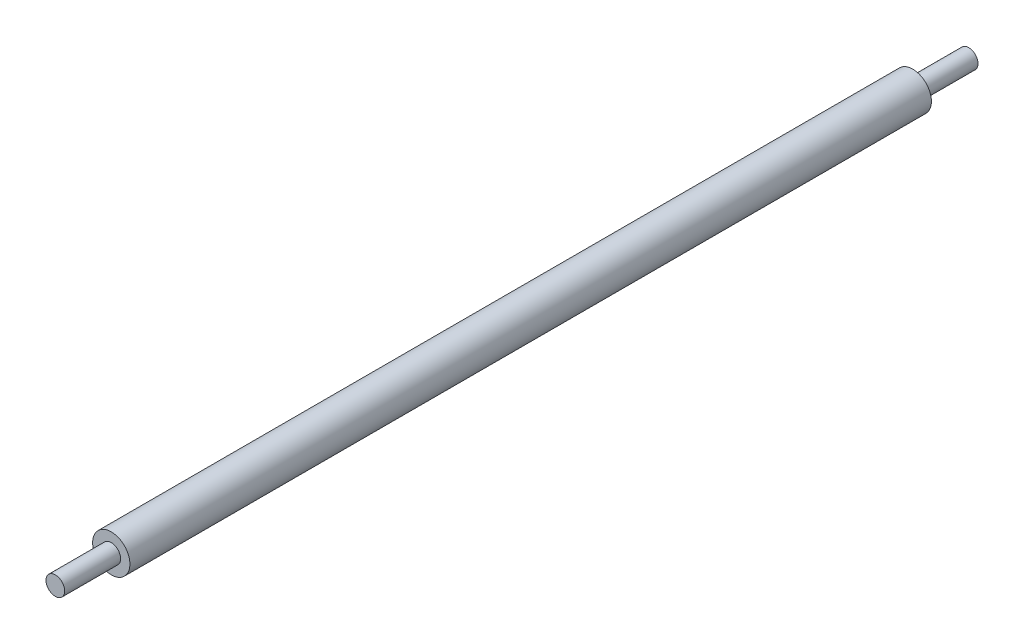
from build123d import *

# Parameters (mm, degrees)
SKETCH1_R           = 12.7
BOSS_EXTRUDE1_DEPTH = 622.3
SKETCH2_OUTSIDE_W   = 152.068
SKETCH2_OUTSIDE_H   = 152.068
SKETCH2_OUTSIDE_R   = 6.361935525
CUT_EXTRUDE1_DEPTH  = 38.1
SKETCH5_OUTSIDE_W   = 152.068
SKETCH5_OUTSIDE_H   = 152.068
SKETCH5_OUTSIDE_R   = 6.377907631
CUT_EXTRUDE4_DEPTH  = 38.1


with BuildPart() as part:
    # Sketch1 → Boss-Extrude1 (new body)
    with BuildSketch(Plane.XY):
        Circle(SKETCH1_R)
    extrude(amount=BOSS_EXTRUDE1_DEPTH)

    # Sketch2 outside → Cut-Extrude1 (cut)
    with BuildSketch(Plane.XY):
        Rectangle(SKETCH2_OUTSIDE_W, SKETCH2_OUTSIDE_H)
        with Locations(Location((0, 0, 0), (0, 0, 180))):
            Circle(SKETCH2_OUTSIDE_R, mode=Mode.SUBTRACT)
    extrude(amount=CUT_EXTRUDE1_DEPTH, mode=Mode.SUBTRACT)

    # Sketch5 outside → Cut-Extrude4 (cut)
    with BuildSketch(Plane.XY.offset(622.3)):
        Rectangle(SKETCH5_OUTSIDE_W, SKETCH5_OUTSIDE_H)
        Circle(SKETCH5_OUTSIDE_R, mode=Mode.SUBTRACT)
    extrude(amount=-CUT_EXTRUDE4_DEPTH, mode=Mode.SUBTRACT)


solid = part.part
